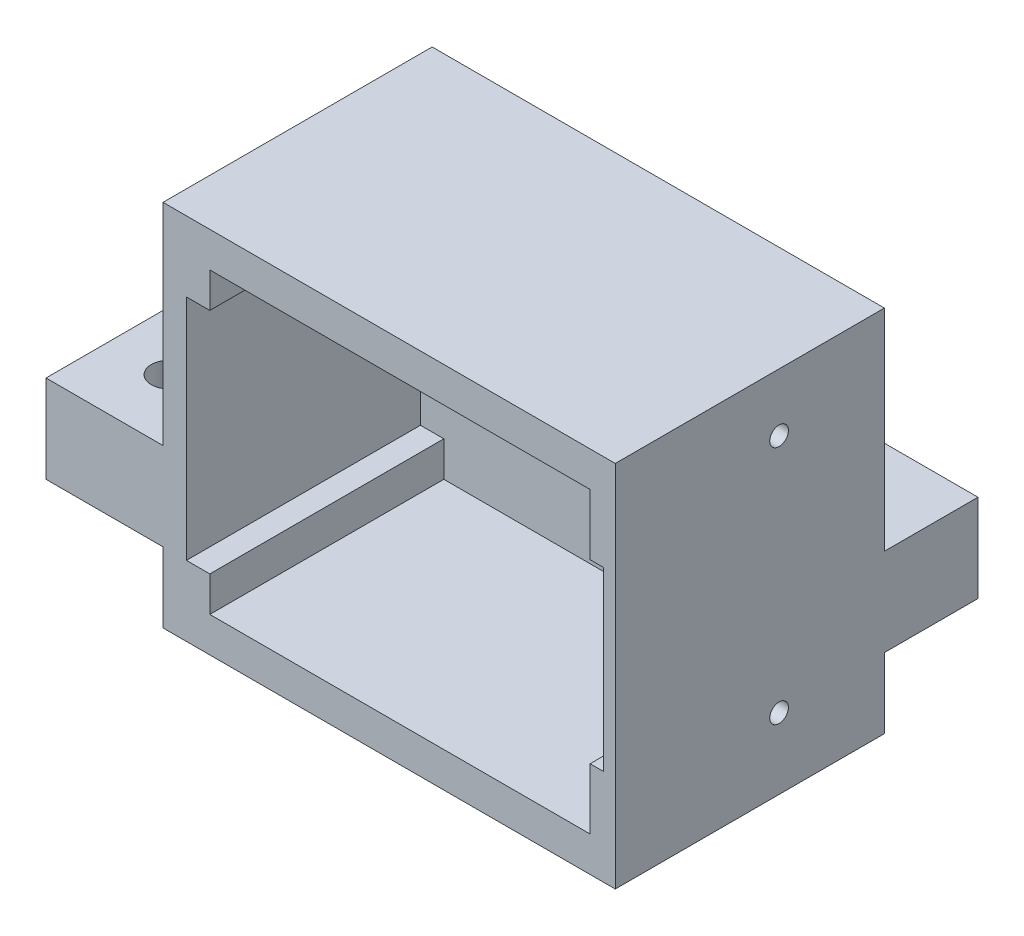
from build123d import *

# Parameters (mm, degrees)
SKETCH1_W           = 38.65
SKETCH1_H           = 23
BOSS_EXTRUDE1_DEPTH = 31.5
CUT_EXTRUDE1_DEPTH  = 20
SKETCH4_R           = 0.8
CUT_EXTRUDE2_DEPTH  = 2.15
BOSS_EXTRUDE2_START = -6
SKETCH7_W           = 10
SKETCH7_H           = 23
SKETCH7_R           = 1.5
SKETCH7_W_2         = 37.65
SKETCH7_H_2         = 8
BOSS_EXTRUDE2_DEPTH = 7.5


with BuildPart() as part:
    # Sketch1 → Boss-Extrude1 (new body)
    with BuildSketch(Plane(origin=(0, 0, 0), x_dir=(1, 0, 0), z_dir=(0, 1, 0))):
        with Locations((19.325, 11.5)):
            Rectangle(SKETCH1_W, SKETCH1_H)
    extrude(amount=BOSS_EXTRUDE1_DEPTH)

    # Sketch3 → Cut-Extrude1 (cut)
    with BuildSketch(Plane.XY):
        Polygon((2, 25.5), (2, 6), (4, 6), (4, 3), (36.5, 3), (36.5, 8.2), (37.65, 8.2), (37.65, 23.3), (36.5, 23.3), (36.5, 28.5), (4, 28.5), (4, 25.5), align=None)
    extrude(amount=-CUT_EXTRUDE1_DEPTH, mode=Mode.SUBTRACT)

    # Sketch4 → Cut-Extrude2 (cut)
    with BuildSketch(Plane.ZY.offset(-36.5)):
        with Locations((-14, 26.55)):
            Circle(SKETCH4_R)
        with Locations((-14, 6.05)):
            Circle(SKETCH4_R)
    extrude(amount=-CUT_EXTRUDE2_DEPTH, mode=Mode.SUBTRACT)

    # Sketch7 → Boss-Extrude2 (add)
    # profile 1 of 2: a face of its own
    with BuildSketch(Plane.XZ.offset(BOSS_EXTRUDE2_START)):
        with Locations((-5, -11.5)):
            Rectangle(SKETCH7_W, SKETCH7_H)
        with Locations(Location((-5, -17.5, 0), (0, 0, 270))):
            Circle(SKETCH7_R, mode=Mode.SUBTRACT)
        with Locations(Location((-5, -5.5, 0), (0, 0, 270))):
            Circle(SKETCH7_R, mode=Mode.SUBTRACT)
    # profile 2 of 2: a face of its own
    with BuildSketch(Plane.XZ.offset(BOSS_EXTRUDE2_START)):
        with Locations((19.825, -27)):
            Rectangle(SKETCH7_W_2, SKETCH7_H_2)
        with Locations(Location((30.65, -27, 0), (0, 0, 270))):
            Circle(SKETCH7_R, mode=Mode.SUBTRACT)
        with Locations(Location((9, -27, 0), (0, 0, 270))):
            Circle(SKETCH7_R, mode=Mode.SUBTRACT)
    extrude(amount=-BOSS_EXTRUDE2_DEPTH)


solid = part.part
